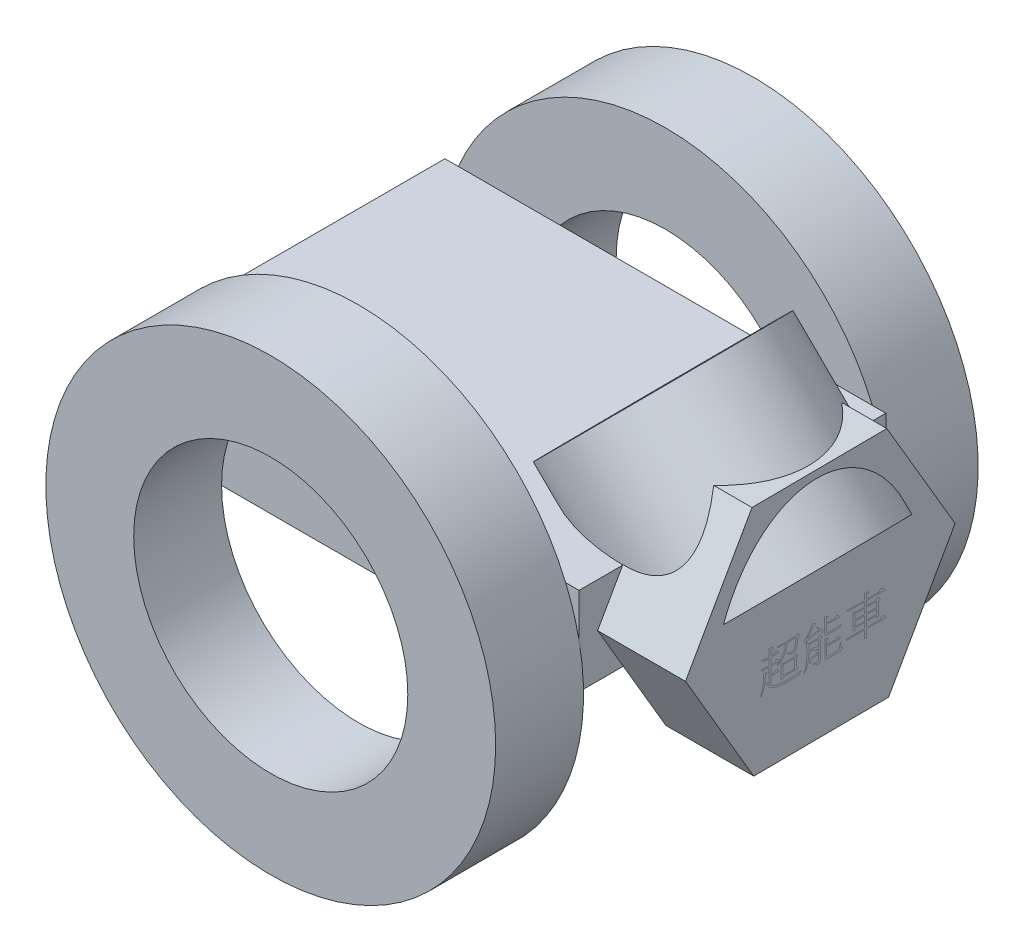
from build123d import *

# Parameters (mm, degrees)
SKETCH_1_W           = 50.17161873
SKETCH_1_H           = 34.913239838
EXTRUDE_1_DEPTH      = 10
SKETCH_2_R           = 25.596904926
SKETCH_2_R_2         = 15.596904926
EXTRUDE_1_2_DEPTH    = 10
EXTRUDE_START        = 10
SKETCH_3_R           = 25.596904926
SKETCH_3_R_2         = 15.596904926
EXTRUDE_2_DEPTH      = 10
EXTRUDE_2_2_DEPTH    = 10
EXTRUDE_3_DEPTH      = 7
EXTRUDE_3_DEPTH_BACK = 12
SKETCH_5_R           = 12.097292752
CUT_EXTRUDE_1_DEPTH  = 63.060098254


with BuildPart() as part:
    # 草圖1 → Extrude 1 (new body)
    with BuildSketch(Plane(origin=(0, 0, 0), x_dir=(1, 0, 0), z_dir=(0, 1, 0))):
        Rectangle(SKETCH_1_W, SKETCH_1_H)
    extrude(amount=EXTRUDE_1_DEPTH)

    # 草圖2 → Extrude 1 2 (add)
    with BuildSketch(Plane.XY.offset(17.456619919)):
        Circle(SKETCH_2_R)
        Circle(SKETCH_2_R_2, mode=Mode.SUBTRACT)
    extrude(amount=EXTRUDE_1_2_DEPTH)

    # 草圖3 → Extrude 2 (add)
    with BuildSketch(Plane(origin=(0, 0, -17.456619919), x_dir=(-1, 0, 0), z_dir=(0, 0, -1)).offset(EXTRUDE_START)):
        Circle(SKETCH_3_R)
        Circle(SKETCH_3_R_2, mode=Mode.SUBTRACT)
    extrude(amount=-EXTRUDE_2_DEPTH)

    # 草圖4 → Extrude 2 2 (add)
    with BuildSketch(Plane(origin=(25.085809365, 0, 0), x_dir=(0, 0, -1), z_dir=(1, 0, 0))):
        Polygon((7.767540636, -8.142290403), (15.342896504, 5.2005267), (7.575355868, 18.432385876), (-7.767540636, 18.321427949), (-15.342896504, 4.978610845), (-7.575355868, -8.253248331), align=None)
    extrude(amount=EXTRUDE_2_2_DEPTH)

    # 草圖5 → 填料-伸長3 (add, two sides: drawn at the far end of the back side and taken through both)
    with BuildSketch(Plane(origin=(8.35434404, -8.354125583, -0.060416002), x_dir=(-0.003615890802849244, 0.003615796250954227, -0.9999869255901167), z_dir=(0.7071067811865482, -0.7070882910578936, -0.005113574955600474)).offset(-EXTRUDE_3_DEPTH_BACK)):
        with Locations((-0.42297231, 25.100981723)):
            Circle(SKETCH_5_R)
    extrude(amount=EXTRUDE_3_DEPTH + EXTRUDE_3_DEPTH_BACK)

    # 草圖6 → 除料-伸長1 (cut, through all)
    with BuildSketch(Plane(origin=(13.304091508, -13.30374362, -0.096211026), x_dir=(-0.0036158908028492477, 0.0036157962509542232, -0.9999869255901167), z_dir=(0.7071067811865483, -0.7070882910578935, -0.005113574955600474))):
        with BuildLine():
            Line((-8.90297564, 31.358512716), (8.125719102, 31.358512716))
            add(Edge.make_bspline(
                [(8.125719102, 31.358512716), (-0.388628269, 41.854112763), (-8.90297564, 31.358512716)],
                knots=[0, 0, 0, 1, 1, 1], degree=2))
        make_face()
    extrude(amount=-CUT_EXTRUDE_1_DEPTH, mode=Mode.SUBTRACT)


solid = part.part
